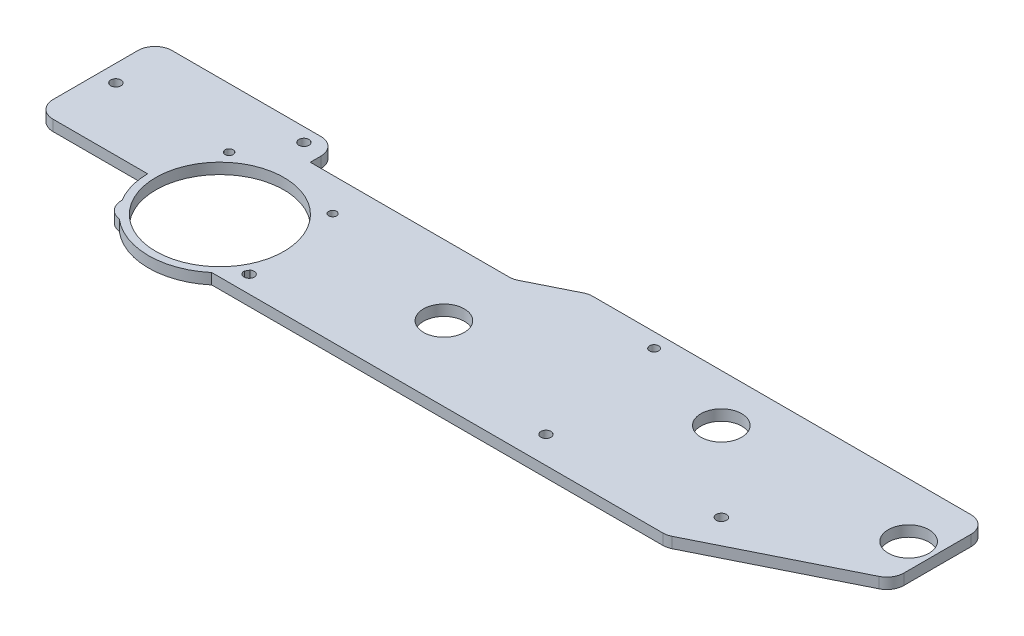
from build123d import *

# Parameters (mm, degrees)
SKETCH1_W           = 210
SKETCH1_H           = 50
SKETCH1_R           = 1.211665018
SKETCH1_R_2         = 1.165617118
SKETCH1_R_3         = 1.5
SKETCH1_R_4         = 1.517273905
SKETCH1_R_5         = 1.335614121
SKETCH1_R_6         = 1.62438417
BOSS_EXTRUDE1_DEPTH = 3.175
SKETCH2_R           = 2
CUT_EXTRUDE1_DEPTH  = 10
SKETCH3_R           = 6
SKETCH3_R_2         = 0.586995366
CUT_EXTRUDE2_DEPTH  = 57.15
CUT_EXTRUDE7_DEPTH  = 10
FILLET3_R           = 5
SKETCH11_R          = 18.5
SKETCH11_R_2        = 2
BOSS_EXTRUDE4_DEPTH = 3.175
SKETCH12_R          = 21
BOSS_EXTRUDE5_DEPTH = 3.175
SKETCH13_R          = 18.85
CUT_EXTRUDE8_DEPTH  = 3.175
BOSS_EXTRUDE6_DEPTH = 3.175
FILLET4_R           = 5
SKETCH15_R          = 1.5
CUT_EXTRUDE9_DEPTH  = 10
SKETCH16_R          = 1.5
CUT_EXTRUDE10_DEPTH = 10
SKETCH17_R          = 1.5
CUT_EXTRUDE11_DEPTH = 10


with BuildPart() as part:
    # Sketch1 → Boss-Extrude1 (new body)
    with BuildSketch(Plane(origin=(0, 0, 0), x_dir=(1, 0, 0), z_dir=(0, 1, 0))):
        with Locations((105, -25)):
            Rectangle(SKETCH1_W, SKETCH1_H)
        with Locations(Location((3.489526233, -16.787661112, 0), (0, 0, 270))):
            Circle(SKETCH1_R, mode=Mode.SUBTRACT)
        with Locations(Location((34.37258772, -17.194005245, 0), (0, 0, 270))):
            Circle(SKETCH1_R_2, mode=Mode.SUBTRACT)
        with Locations(Location((37.520749958, -44.921198121, 0), (0, 0, 270))):
            Circle(SKETCH1_R_3, mode=Mode.SUBTRACT)
        with Locations(Location((168.975233936, -37.403209633, 0), (0, 0, 270))):
            Circle(SKETCH1_R_4, mode=Mode.SUBTRACT)
        with Locations(Location((116, -4.237214774, 0), (0, 0, 270))):
            Circle(SKETCH1_R_5, mode=Mode.SUBTRACT)
        with Locations(Location((12.257640281, -3.274812063, 0), (0, 0, 270))):
            Circle(SKETCH1_R_6, mode=Mode.SUBTRACT)
    extrude(amount=BOSS_EXTRUDE1_DEPTH)

    # Sketch2 → Cut-Extrude1 (cut)
    with BuildSketch(Plane(origin=(0, 3.175, 0), x_dir=(1, 0, 0), z_dir=(0, 1, 0))):
        with Locations(Location((10, -26, 0), (0, 0, 270))):
            Circle(SKETCH2_R)
        with Locations(Location((10, -42, 0), (0, 0, 270))):
            Circle(SKETCH2_R)
        with Locations(Location((26, -26, 0), (0, 0, 270))):
            Circle(SKETCH2_R)
        with Locations(Location((26, -42, 0), (0, 0, 270))):
            Circle(SKETCH2_R)
    extrude(amount=-CUT_EXTRUDE1_DEPTH, mode=Mode.SUBTRACT)

    # Sketch3 → Cut-Extrude2 (cut)
    with BuildSketch(Plane(origin=(0, 3.175, 0), x_dir=(1, 0, 0), z_dir=(0, 1, 0))):
        with Locations(Location((78.01026379, -28.1, 0), (0, 0, 270))):
            Circle(SKETCH3_R)
        with Locations(Location((145.531297368, -14, 0), (0, 0, 270))):
            Circle(SKETCH3_R)
        with Locations(Location((18, -34, 0), (0, 0, 270))):
            Circle(SKETCH3_R_2)
        with Locations(Location((202.646291021, -16, 0), (0, 0, 270))):
            Circle(SKETCH3_R)
    extrude(amount=-CUT_EXTRUDE2_DEPTH, mode=Mode.SUBTRACT)

    # Sketch10 → Cut-Extrude7 (cut)
    with BuildSketch(Plane(origin=(0, 3.175, 0), x_dir=(1, 0, 0), z_dir=(0, 1, 0))):
        Polygon((210, -27.859435908), (165.502877994, -50), (210, -50), align=None)
        Polygon((92.532613397, 0), (77.65477062, -7.402812063), (0, -7.402812063), (0, 0), align=None)
    extrude(amount=-CUT_EXTRUDE7_DEPTH, mode=Mode.SUBTRACT)

    # Fillet3
    fillet3_edges = [part.edges().sort_by_distance(p)[0] for p in [
        (210, 1.5875, 0),
        (0, 1.5875, 50),
        (92.532613397, 1.5875, 0),
        (210, 1.5875, 27.859435908),
        (165.502877994, 1.5875, 50),
        (77.65477062, 1.5875, 7.402812063),
        (0, 1.5875, 7.402812063),
    ]]
    fillet(fillet3_edges, radius=FILLET3_R)

    # Sketch11 → Boss-Extrude4 (add)
    with BuildSketch(Plane(origin=(0, 3.175, 0), x_dir=(1, 0, 0), z_dir=(0, 1, 0))):
        with Locations((18, -34)):
            Circle(SKETCH11_R)
        with Locations(Location((10, -26, 0), (0, 0, 270))):
            Circle(SKETCH11_R_2, mode=Mode.SUBTRACT)
        with Locations(Location((10, -42, 0), (0, 0, 270))):
            Circle(SKETCH11_R_2, mode=Mode.SUBTRACT)
        with Locations(Location((26, -26, 0), (0, 0, 270))):
            Circle(SKETCH11_R_2, mode=Mode.SUBTRACT)
        with Locations(Location((26, -42, 0), (0, 0, 270))):
            Circle(SKETCH11_R_2, mode=Mode.SUBTRACT)
    extrude(amount=-BOSS_EXTRUDE4_DEPTH)

    # Sketch12 → Boss-Extrude5 (add)
    with BuildSketch(Plane(origin=(0, 3.175, 0), x_dir=(1, 0, 0), z_dir=(0, 1, 0))):
        with Locations((18, -34)):
            Circle(SKETCH12_R)
    extrude(amount=-BOSS_EXTRUDE5_DEPTH)

    # Sketch13 → Cut-Extrude8 (cut)
    with BuildSketch(Plane(origin=(0, 3.175, 0), x_dir=(1, 0, 0), z_dir=(0, 1, 0))):
        with Locations(Location((18, -34, 0), (0, 0, 270))):
            Circle(SKETCH13_R)
    extrude(amount=-CUT_EXTRUDE8_DEPTH, mode=Mode.SUBTRACT)

    # Sketch14 → Boss-Extrude6 (add)
    with BuildSketch(Plane(origin=(0, 3.175, 0), x_dir=(1, 0, 0), z_dir=(0, 1, 0))):
        with BuildLine():
            Line((-35.83, -34.272812063), (-2.998227868, -34.272812063))
            ThreePointArc((-2.998227868, -34.272812063), (-2.272136238, -28.519079241), (0, -23.183346174))
            Line((0, -23.183346174), (0, -12.402812063))
            Line((0, -12.402812063), (0, -12.248529085))
            Line((0, -12.248529085), (0, 0.727187937))
            Line((0, 0.727187937), (-35.83, 0.727187937))
            Line((-35.83, 0.727187937), (-35.83, -34.272812063))
        make_face()
        with BuildLine():
            Line((0, 0.727187937), (0, -12.248529085))
            Line((0, -12.248529085), (0.002380891, -12.248529085))
            ThreePointArc((0.002380891, -12.248529085), (1.51944077, -8.813145304), (5, -7.402812063))
            Line((5, -7.402812063), (18, -7.402812063))
            Line((18, -7.402812063), (18, 0.727187937))
            Line((18, 0.727187937), (0, 0.727187937))
        make_face()
    extrude(amount=-BOSS_EXTRUDE6_DEPTH)

    # Fillet4
    fillet4_edges = [part.edges().sort_by_distance(p)[0] for p in [
        (-35.83, 1.5875, 34.272812063),
        (-35.83, 1.5875, -0.727187937),
        (18, 1.5875, -0.727187937),
    ]]
    fillet(fillet4_edges, radius=FILLET4_R)

    # Sketch15 → Cut-Extrude9 (cut)
    with BuildSketch(Plane(origin=(0, 3.175, 0), x_dir=(1, 0, 0), z_dir=(0, 1, 0))):
        with Locations(Location((122, -42.058139805, 0), (0, 0, 270))):
            Circle(SKETCH15_R)
    extrude(amount=-CUT_EXTRUDE9_DEPTH, mode=Mode.SUBTRACT)

    # Sketch16 → Cut-Extrude10 (cut)
    with BuildSketch(Plane(origin=(0, 3.175, 0), x_dir=(1, 0, 0), z_dir=(0, 1, 0))):
        with Locations(Location((12, -3.272812063, 0), (0, 0, 270))):
            Circle(SKETCH16_R)
    extrude(amount=-CUT_EXTRUDE10_DEPTH, mode=Mode.SUBTRACT)

    # Sketch17 → Cut-Extrude11 (cut)
    with BuildSketch(Plane(origin=(0, 3.175, 0), x_dir=(1, 0, 0), z_dir=(0, 1, 0))):
        with Locations(Location((-30.83, -15.772812063, 0), (0, 0, 270))):
            Circle(SKETCH17_R)
    extrude(amount=-CUT_EXTRUDE11_DEPTH, mode=Mode.SUBTRACT)


solid = part.part
